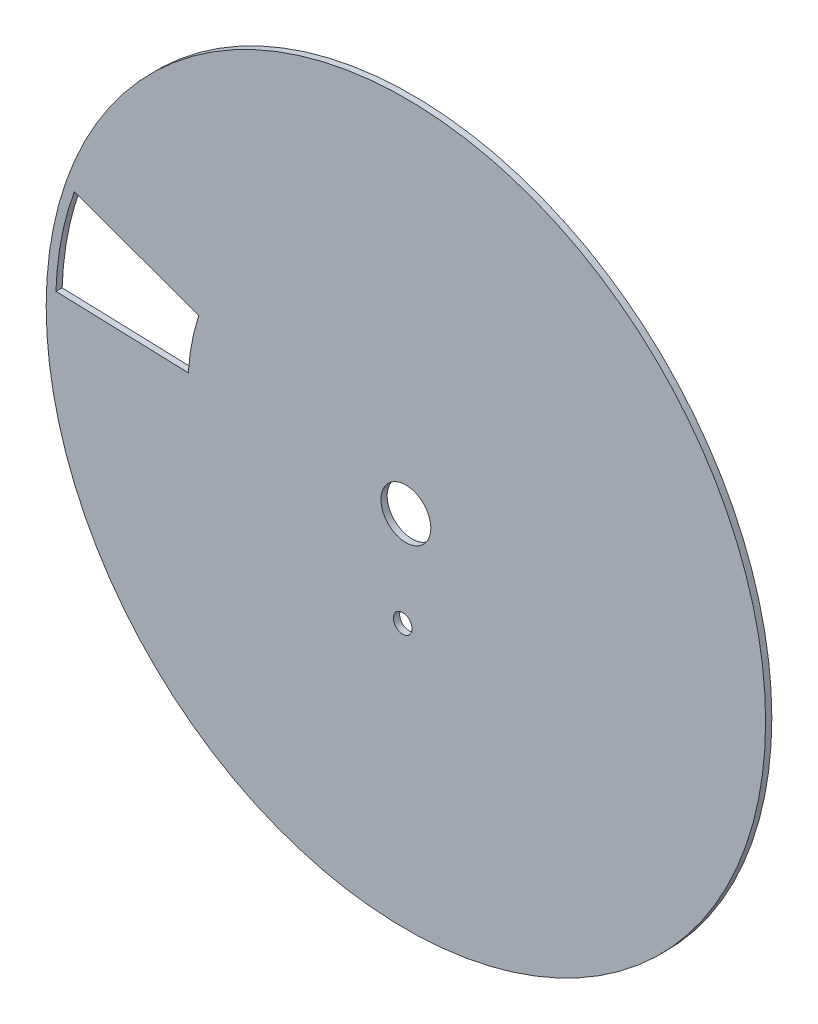
from build123d import *

# Parameters (mm, degrees)
ESQUISSE1_R             = 57.75
BOSS_EXTRU_1_DEPTH      = 1
ESQUISSE2_R             = 4
ENL_V_MAT_EXTRU_1_DEPTH = 10
ENL_V_MAT_EXTRU_4_DEPTH = 10
ESQUISSE5_R             = 1.5
ENL_V_MAT_EXTRU_5_DEPTH = 10


with BuildPart() as part:
    # Esquisse1 → Boss.-Extru.1 (new body)
    with BuildSketch(Plane.XY):
        Circle(ESQUISSE1_R)
    extrude(amount=BOSS_EXTRU_1_DEPTH)

    # Esquisse2 → Enlèv. mat.-Extru.1 (cut)
    with BuildSketch(Plane.XY.offset(1)):
        Circle(ESQUISSE2_R)
    extrude(amount=-ENL_V_MAT_EXTRU_1_DEPTH, mode=Mode.SUBTRACT)

    # Esquisse4 → Enlèv. mat.-Extru.4 (cut)
    with BuildSketch(Plane(origin=(0, 0, 0), x_dir=(-1, 0, 0), z_dir=(0, 0, -1))):
        with BuildLine():
            Line((33.243703386, 10.947884963), (53.229228234, 18.16877802))
            ThreePointArc((53.229228234, 18.16877802), (55.31077904, 10.615789501), (56.184630477, 2.830105651))
            Line((56.184630477, 2.830105651), (34.934630477, 2.138128484))
            ThreePointArc((34.934630477, 2.138128484), (34.372579979, 6.597404459), (33.243703386, 10.947884963))
        make_face()
    extrude(amount=-ENL_V_MAT_EXTRU_4_DEPTH, mode=Mode.SUBTRACT)

    # Esquisse5 → Enlèv. mat.-Extru.5 (cut)
    with BuildSketch(Plane(origin=(0, 0, 0), x_dir=(-1, 0, 0), z_dir=(0, 0, -1))):
        with Locations((0.504599234, -15.495791231)):
            Circle(ESQUISSE5_R)
    extrude(amount=-ENL_V_MAT_EXTRU_5_DEPTH, mode=Mode.SUBTRACT)


solid = part.part
